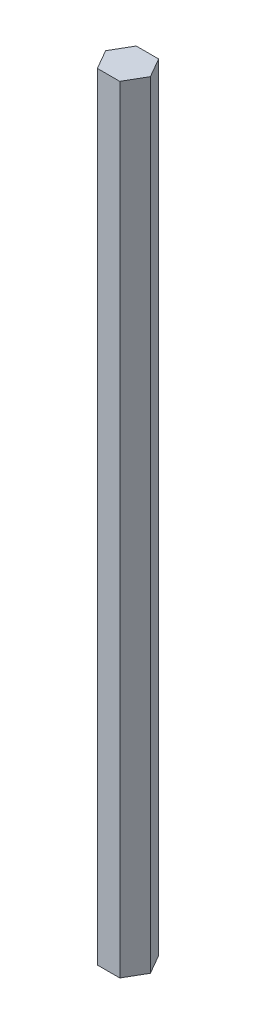
from build123d import *

# Parameters (mm, degrees)
BOSS_EXTRUDE1_DEPTH = 254


with BuildPart() as part:
    # Sketch1 → Boss-Extrude1 (new body)
    with BuildSketch(Plane(origin=(0, 0, 0), x_dir=(1, 0, 0), z_dir=(0, 1, 0))):
        Polygon((7.332348419, 0), (3.666174209, 6.35), (-3.666174209, 6.35), (-7.332348419, 0), (-3.666174209, -6.35), (3.666174209, -6.35), align=None)
    extrude(amount=BOSS_EXTRUDE1_DEPTH)


solid = part.part
